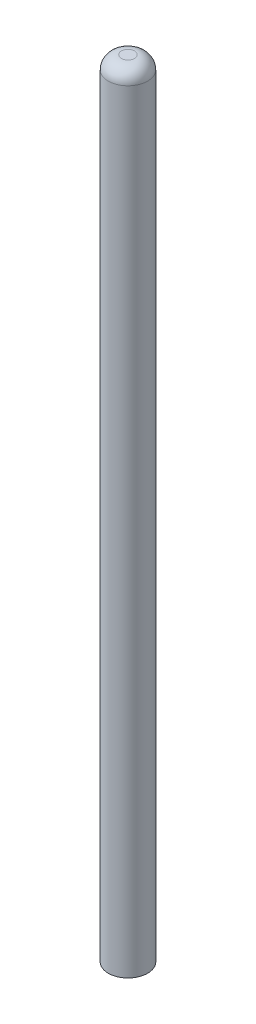
from build123d import *

# Parameters (mm, degrees)
SKETCH1_R           = 1.5
BOSS_EXTRUDE1_DEPTH = 60
FILLET1_R           = 1


with BuildPart() as part:
    # Sketch1 → Boss-Extrude1 (new body)
    with BuildSketch(Plane(origin=(0, 0, 0), x_dir=(1, 0, 0), z_dir=(0, 1, 0))):
        with Locations(Location((0, 0, 0), (0, 0, 270))):
            Circle(SKETCH1_R)
    extrude(amount=BOSS_EXTRUDE1_DEPTH)

    # Fillet1
    fillet1_edges = [part.edges().sort_by_distance(p)[0] for p in [
        (0, 60, -1.5),
    ]]
    fillet(fillet1_edges, radius=FILLET1_R)


solid = part.part
